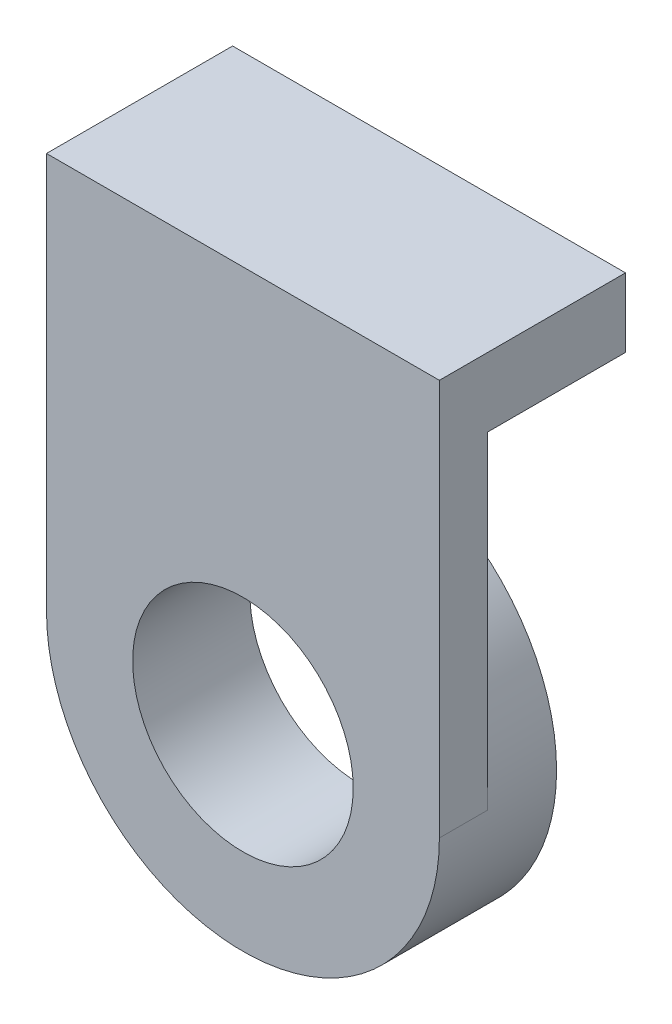
from build123d import *

# Parameters (mm, degrees)
SZKIC1_R                    = 2.85
SZKIC1_R_2                  = 1.6
DODANIE_WYCI_GNI_CIE1_DEPTH = 1
DODANIE_WYCI_GNI_CIE2_DEPTH = 0.7
SZKIC3_W                    = 5.7
SZKIC3_H                    = 1
DODANIE_WYCI_GNI_CIE3_DEPTH = 2


with BuildPart() as part:
    # Szkic1 → Dodanie-wyciągnięcie1 (new body)
    with BuildSketch(Plane.XY):
        Circle(SZKIC1_R)
        Circle(SZKIC1_R_2, mode=Mode.SUBTRACT)
    extrude(amount=DODANIE_WYCI_GNI_CIE1_DEPTH)

    # Szkic2 → Dodanie-wyciągnięcie2 (add)
    with BuildSketch(Plane.XY.offset(1)):
        with BuildLine():
            Line((2.85, 5.75), (0, 5.75))
            Line((0, 5.75), (-2.85, 5.75))
            Line((-2.85, 5.75), (-2.85, 0))
            ThreePointArc((-2.85, 0), (0, -2.85), (2.85, 0))
            Line((2.85, 0), (2.85, 5.75))
        make_face()
        with BuildLine():
            ThreePointArc((1.6, 0), (-1.13137085, -1.13137085), (0, 1.6))
            ThreePointArc((0, 1.6), (1.13137085, 1.13137085), (1.6, 0))
        make_face(mode=Mode.SUBTRACT)
    extrude(amount=DODANIE_WYCI_GNI_CIE2_DEPTH)

    # Szkic3 → Dodanie-wyciągnięcie3 (add)
    with BuildSketch(Plane(origin=(0, 0, 1), x_dir=(-1, 0, 0), z_dir=(0, 0, -1))):
        with Locations((0, 5.25)):
            Rectangle(SZKIC3_W, SZKIC3_H)
    extrude(amount=DODANIE_WYCI_GNI_CIE3_DEPTH)


solid = part.part
